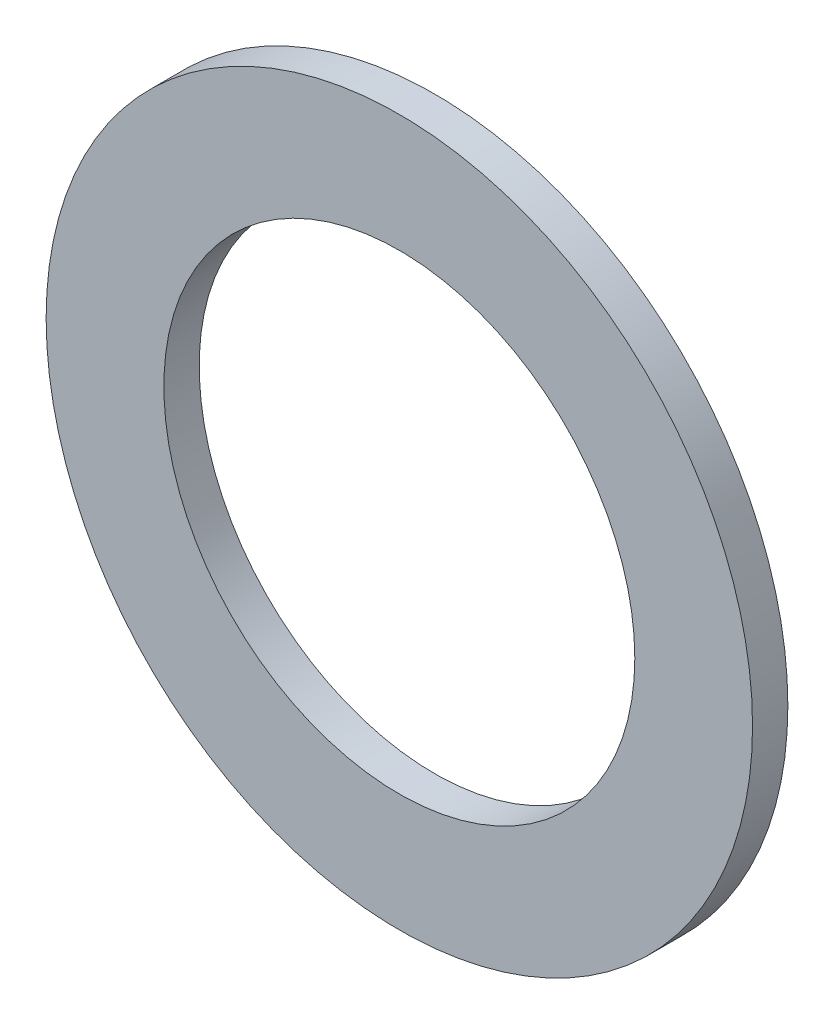
from build123d import *

# Parameters (mm, degrees)
SKETCH_2_R      = 30
SKETCH_2_R_2    = 20
EXTRUDE_1_DEPTH = 3


with BuildPart() as part:
    # 草图2 → 凸台-拉伸1 (new body)
    with BuildSketch(Plane.XY):
        Circle(SKETCH_2_R)
        Circle(SKETCH_2_R_2, mode=Mode.SUBTRACT)
    extrude(amount=EXTRUDE_1_DEPTH)


solid = part.part
